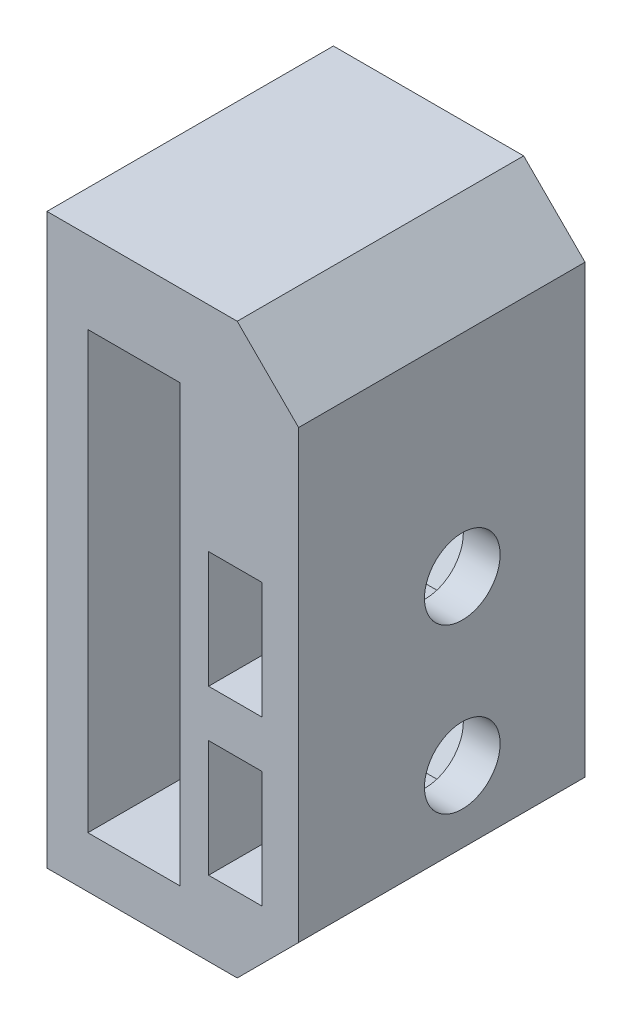
from build123d import *

# Parameters (mm, degrees)
SKETCH1_W           = 26.3
SKETCH1_H           = 14
SKETCH1_W_2         = 21.3
SKETCH1_H_2         = 9
EXTRUDE_THIN1_DEPTH = 4.5
SKETCH2_W           = 26.3
SKETCH2_H           = 14
BOSS_EXTRUDE1_DEPTH = 5.8
SKETCH3_W           = 26.3
SKETCH3_H           = 14
BOSS_EXTRUDE2_DEPTH = 2
SKETCH4_W           = 4.5
SKETCH4_H           = 21.3
CUT_EXTRUDE1_DEPTH  = 18
CUT_EXTRUDE4_DEPTH  = 4
SKETCH8_W           = 21.3
SKETCH8_H           = 11.5
BOSS_EXTRUDE3_DEPTH = 1.4
SKETCH5_R           = 1.85
CUT_EXTRUDE2_DEPTH  = 10
SKETCH9_W           = 12.3
SKETCH9_H           = 14
BOSS_EXTRUDE4_DEPTH = 1.5
CHAMFER1_SIZE       = 3


with BuildPart() as part:
    # Sketch1 → Extrude-Thin1 (new body)
    with BuildSketch(Plane.YZ):
        with Locations((10.65, 4.5)):
            Rectangle(SKETCH1_W, SKETCH1_H)
        with Locations((10.65, 4.5)):
            Rectangle(SKETCH1_W_2, SKETCH1_H_2, mode=Mode.SUBTRACT)
    extrude(amount=EXTRUDE_THIN1_DEPTH)

    # Sketch2 → Boss-Extrude1 (add)
    with BuildSketch(Plane.YZ.offset(4.5)):
        with Locations((10.65, 4.5)):
            Rectangle(SKETCH2_W, SKETCH2_H)
    extrude(amount=BOSS_EXTRUDE1_DEPTH)

    # Sketch3 → Boss-Extrude2 (add)
    with BuildSketch(Plane(origin=(0, 0, 0), x_dir=(0, -1, 0), z_dir=(-1, 0, 0))):
        with Locations((-10.65, 4.5)):
            Rectangle(SKETCH3_W, SKETCH3_H)
    extrude(amount=BOSS_EXTRUDE2_DEPTH)

    # Sketch4 → Cut-Extrude1 (cut)
    with BuildSketch(Plane(origin=(0, 0, 9), x_dir=(1, 0, 0), z_dir=(0, 0, -1))):
        with Locations((2.25, -10.65)):
            Rectangle(SKETCH4_W, SKETCH4_H)
    extrude(amount=-CUT_EXTRUDE1_DEPTH, mode=Mode.SUBTRACT)

    # Sketch7 → Cut-Extrude4 (cut)
    with BuildSketch(Plane(origin=(4.5, 0, 0), x_dir=(0, -1, 0), z_dir=(-1, 0, 0))):
        Polygon((-14.85, 6.279660954), (-14.85, 11.5), (-9.15, 11.5), (-9.15, 6.691276574), (-9.15, 1.854551733), (-12, 0.209103466), (-14.85, 1.854551733), align=None)
        Polygon((-6.85, 1.854551733), (-4, 0.209103466), (-1.15, 1.854551733), (-1.15, 5.098904977), (-1.15, 11.5), (-6.85, 11.5), (-6.85, 5.026706695), align=None)
    extrude(amount=-CUT_EXTRUDE4_DEPTH, mode=Mode.SUBTRACT)

    # Sketch8 → Boss-Extrude3 (add)
    with BuildSketch(Plane(origin=(4.5, 0, 0), x_dir=(0, -1, 0), z_dir=(-1, 0, 0))):
        with Locations((-10.65, 5.75)):
            Rectangle(SKETCH8_W, SKETCH8_H)
    extrude(amount=-BOSS_EXTRUDE3_DEPTH)

    # Sketch5 → Cut-Extrude2 (cut)
    with BuildSketch(Plane.YZ.offset(10.3)):
        with Locations(Location((4, 3.5, 0), (0, 0, 270))):
            Circle(SKETCH5_R)
        with Locations(Location((12, 3.5, 0), (0, 0, 270))):
            Circle(SKETCH5_R)
    extrude(amount=-CUT_EXTRUDE2_DEPTH, mode=Mode.SUBTRACT)

    # Sketch9 → Boss-Extrude4 (add)
    with BuildSketch(Plane(origin=(0, 23.8, 0), x_dir=(-1, 0, 0), z_dir=(0, 1, 0))):
        with Locations((-4.15, 4.5)):
            Rectangle(SKETCH9_W, SKETCH9_H)
    extrude(amount=BOSS_EXTRUDE4_DEPTH)

    # Chamfer1
    chamfer1_edges = [part.edges().sort_by_distance(p)[0] for p in [
        (10.3, 25.3, 4.5),
        (10.3, -2.5, 4.5),
    ]]
    chamfer(chamfer1_edges, length=CHAMFER1_SIZE)


solid = part.part
